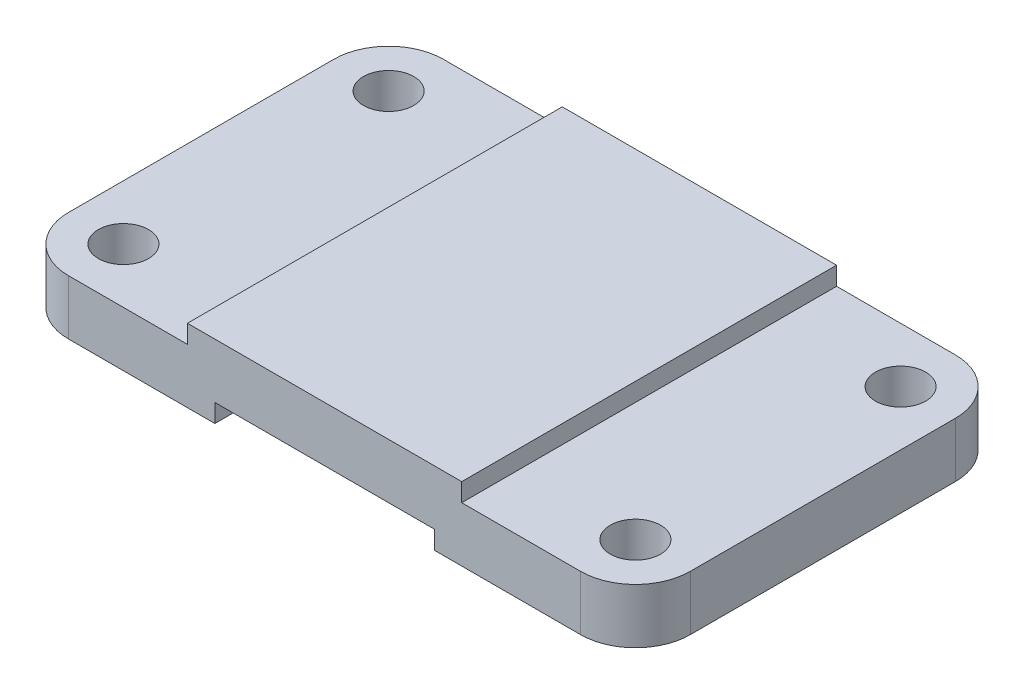
from build123d import *

# Parameters (mm, degrees)
ESQUISSE1_W             = 136
ESQUISSE1_H             = 82
BOSS_EXTRU_1_DEPTH      = 16
ESQUISSE2_W             = 48
ESQUISSE2_H             = 4
ESQUISSE2_W_2           = 38
ENL_V_MAT_EXTRU_1_DEPTH = 108.721864076
ESQUISSE3_R             = 5.5
ENL_V_MAT_EXTRU_3_DEPTH = 81.305666052
CONG_3_R                = 12


with BuildPart() as part:
    # Esquisse1 → Boss.-Extru.1 (new body)
    with BuildSketch(Plane(origin=(0, 0, 0), x_dir=(1, 0, 0), z_dir=(0, 1, 0))):
        Rectangle(ESQUISSE1_W, ESQUISSE1_H)
    extrude(amount=BOSS_EXTRU_1_DEPTH)

    # Esquisse2 → Enlèv. mat.-Extru.1 (cut, through all)
    with BuildSketch(Plane.XY.offset(41)):
        with Locations((0, 2)):
            Rectangle(ESQUISSE2_W, ESQUISSE2_H)
        with Locations((-49, 14)):
            Rectangle(ESQUISSE2_W_2, ESQUISSE2_H)
        with Locations((49, 14)):
            Rectangle(ESQUISSE2_W_2, ESQUISSE2_H)
    extrude(amount=-ENL_V_MAT_EXTRU_1_DEPTH, mode=Mode.SUBTRACT)

    # Esquisse3 → Enlèv. mat.-Extru.3 (cut, through all)
    with BuildSketch(Plane(origin=(0, 12, 0), x_dir=(1, 0, 0), z_dir=(0, 1, 0))):
        with Locations(Location((-56, 29, 0), (0, 0, 270))):
            Circle(ESQUISSE3_R)
        with Locations(Location((-56, -29, 0), (0, 0, 270))):
            Circle(ESQUISSE3_R)
        with Locations(Location((56, -29, 0), (0, 0, 270))):
            Circle(ESQUISSE3_R)
        with Locations(Location((56, 29, 0), (0, 0, 270))):
            Circle(ESQUISSE3_R)
    extrude(amount=-ENL_V_MAT_EXTRU_3_DEPTH, mode=Mode.SUBTRACT)

    # Congé3
    cong_3_edges = [part.edges().sort_by_distance(p)[0] for p in [
        (68, 6, 41),
        (-68, 6, 41),
        (-68, 6, -41),
        (68, 6, -41),
    ]]
    fillet(cong_3_edges, radius=CONG_3_R)


solid = part.part
